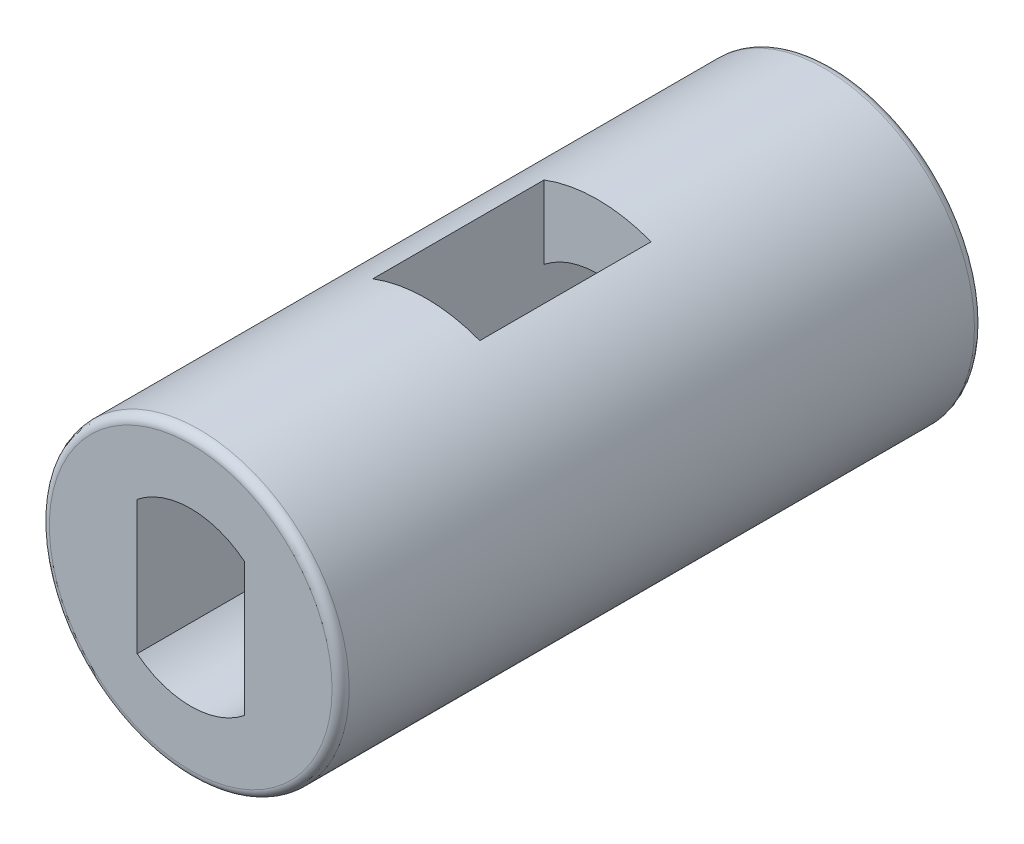
from build123d import *

# Parameters (mm, degrees)
EXTRUDE_1_DEPTH                 = 7.5
EXTRUDE_1_DEPTH_BACK            = 7.5
SKETCH_1_R                      = 3.5
CUT_EXTRUDE_1_REACH             = 10.986
SKETCH_2_W                      = 2.5
SKETCH_2_H                      = 4
CUT_EXTRUDE_1_DIRECTION_2_REACH = 10.986
FILLET_1_R                      = 0.2


with BuildPart() as part:
    # 草图1 → 凸台-拉伸1 (new, two sides: drawn at the far end of the back side and taken through both)
    with BuildSketch(Plane.XY.offset(-EXTRUDE_1_DEPTH_BACK)):
        Circle(SKETCH_1_R)
        with BuildLine():
            Line((-1.25, 1.5612495), (-1.25, -1.5612495))
            ThreePointArc((-1.25, -1.5612495), (0, -2), (1.25, -1.5612495))
            Line((1.25, -1.5612495), (1.25, 1.5612495))
            ThreePointArc((1.25, 1.5612495), (0, 2), (-1.25, 1.5612495))
        make_face(mode=Mode.SUBTRACT)
    extrude(amount=EXTRUDE_1_DEPTH + EXTRUDE_1_DEPTH_BACK)

    # 草图2 → 切除-拉伸1 (cut, up to next)
    with BuildSketch(Plane(origin=(0, 0, 0), x_dir=(1, 0, 0), z_dir=(0, 1, 0)), mode=Mode.PRIVATE) as cut_extrude_1_sk1:
        Rectangle(SKETCH_2_W, SKETCH_2_H)
    cut_extrude_1_tool1 = extrude(cut_extrude_1_sk1.sketch, amount=-CUT_EXTRUDE_1_REACH, mode=Mode.PRIVATE) & part.part
    add(cut_extrude_1_tool1.solids().sort_by_distance((0, 0, 0))[0], mode=Mode.SUBTRACT)

    # 草图2 → 切除-拉伸1 direction 2 (cut, up to next)
    with BuildSketch(Plane(origin=(0, 0, 0), x_dir=(1, 0, 0), z_dir=(0, 1, 0)), mode=Mode.PRIVATE) as cut_extrude_1_direction_2_sk1:
        Rectangle(SKETCH_2_W, SKETCH_2_H)
    cut_extrude_1_direction_2_tool1 = extrude(cut_extrude_1_direction_2_sk1.sketch, amount=CUT_EXTRUDE_1_DIRECTION_2_REACH, mode=Mode.PRIVATE) & part.part
    add(cut_extrude_1_direction_2_tool1.solids().sort_by_distance((0, 0, 0))[0], mode=Mode.SUBTRACT)

    # 圆角1
    fillet_1_edges = [part.edges().sort_by_distance(p)[0] for p in [
        (-3.5, 0, -7.5),
        (-3.5, 0, 7.5),
    ]]
    fillet(fillet_1_edges, radius=FILLET_1_R)


solid = part.part
